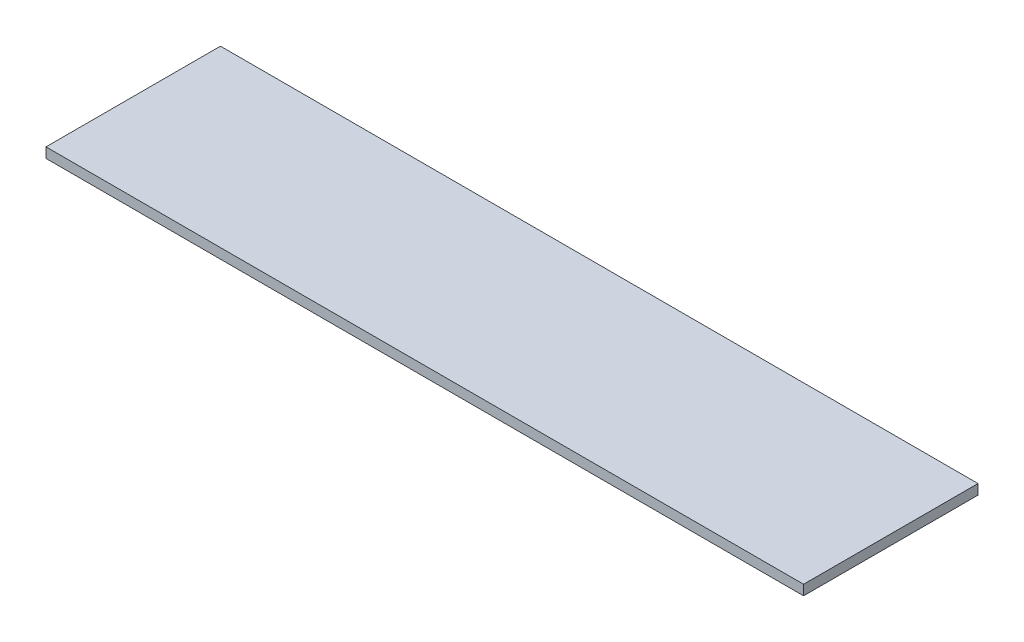
from build123d import *

# Parameters (mm, degrees)
SKETCH1_W           = 150.7
SKETCH1_H           = 34.7
BOSS_EXTRUDE1_DEPTH = 2


with BuildPart() as part:
    # Sketch1 → Boss-Extrude1 (new body)
    with BuildSketch(Plane(origin=(0, 0, 0), x_dir=(1, 0, 0), z_dir=(0, 1, 0))):
        Rectangle(SKETCH1_W, SKETCH1_H)
    extrude(amount=BOSS_EXTRUDE1_DEPTH)


solid = part.part
